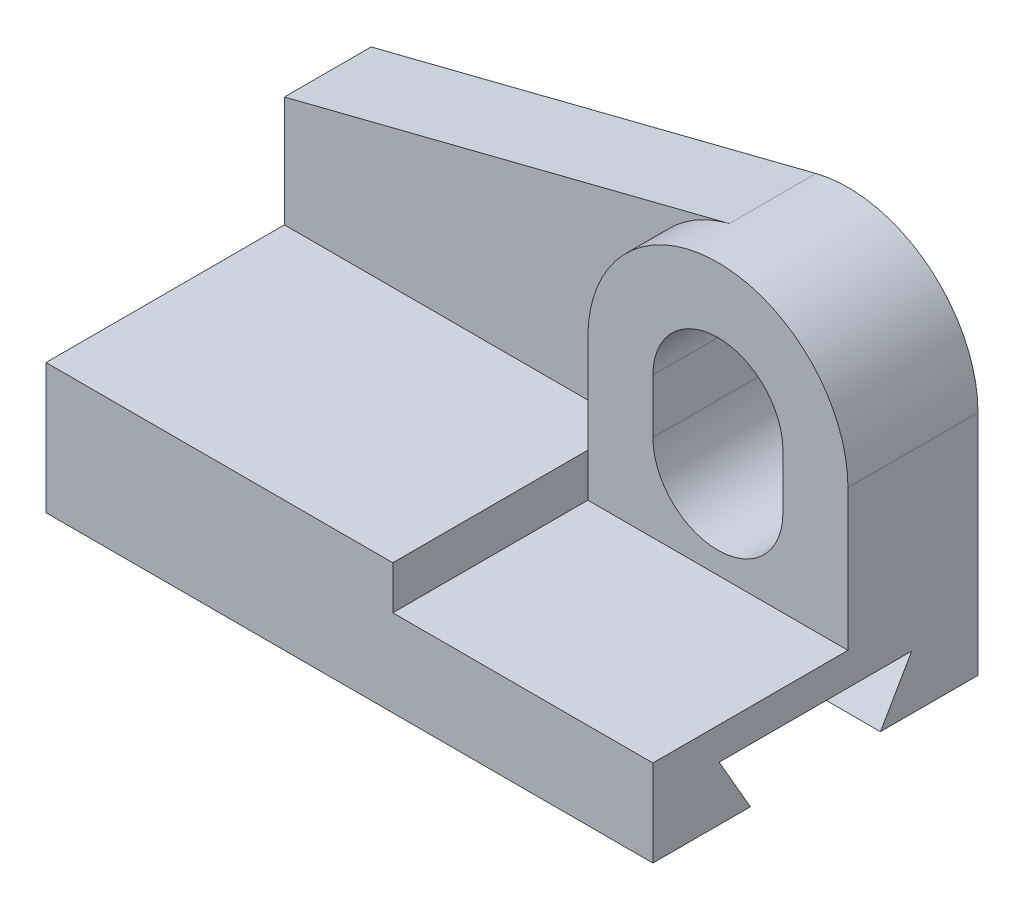
from build123d import *

# Parameters (mm, degrees)
SKETCH_1_W               = 56
SKETCH_1_H               = 30
EXTRUDE_1_DEPTH          = 8
SKETCH_3_W               = 32
SKETCH_3_H               = 30
EXTRUDE_2_DEPTH          = 4
EXTRUDE_3_DEPTH          = 12
EXTRUDE_4_DEPTH          = 8
CUT_EXTRUDE_1_DEPTH      = 46.803929962
CUT_EXTRUDE_1_DEPTH_BACK = 46.803929962


with BuildPart() as part:
    # 草图1 → 凸台-拉伸1 (new body)
    with BuildSketch(Plane(origin=(0, 0, 0), x_dir=(1, 0, 0), z_dir=(0, 1, 0))):
        Rectangle(SKETCH_1_W, SKETCH_1_H)
    extrude(amount=EXTRUDE_1_DEPTH)

    # 草图3 → 凸台-拉伸2 (add)
    with BuildSketch(Plane(origin=(0, 8, 0), x_dir=(1, 0, 0), z_dir=(0, 1, 0))):
        with Locations((-12, 0)):
            Rectangle(SKETCH_3_W, SKETCH_3_H)
    extrude(amount=EXTRUDE_2_DEPTH)

    # 草图7 → 凸台-拉伸3 (add)
    with BuildSketch(Plane.XY.offset(-15)):
        with BuildLine():
            Line((4, 21), (4, 12))
            Line((4, 12), (4, 8))
            Line((4, 8), (28, 8))
            Line((28, 8), (28, 21))
            ThreePointArc((28, 21), (23.368860948, 30.471002499), (13.050018612, 32.631750075))
            ThreePointArc((13.050018612, 32.631750075), (6.528997501, 28.368860948), (4, 21))
        make_face()
        with BuildLine():
            ThreePointArc((10, 21), (16, 27), (22, 21))
            Line((22, 21), (22, 16))
            ThreePointArc((22, 16), (16, 10), (10, 16))
            Line((10, 16), (10, 21))
        make_face(mode=Mode.SUBTRACT)
    extrude(amount=EXTRUDE_3_DEPTH)

    # 草图7<4> → 凸台-拉伸4 (add)
    with BuildSketch(Plane.XY.offset(-15)):
        with BuildLine():
            Line((-28, 22.220866923), (-28, 12))
            Line((-28, 12), (4, 12))
            Line((4, 12), (4, 21))
            ThreePointArc((4, 21), (6.528997501, 28.368860948), (13.050018612, 32.631750075))
            Line((13.050018612, 32.631750075), (-28, 22.220866923))
        make_face()
    extrude(amount=EXTRUDE_4_DEPTH)

    # 草图13 → 切除-拉伸1 (cut, two sides: drawn at the far end of the back side and taken through both)
    with BuildSketch(Plane(origin=(0, 0, 0), x_dir=(0, 0, -1), z_dir=(1, 0, 0)).offset(-CUT_EXTRUDE_1_DEPTH_BACK)):
        Polygon((-6, 0), (0, 0), (6, 0), (8.886751346, 5), (-8.886751346, 5), align=None)
    extrude(amount=CUT_EXTRUDE_1_DEPTH + CUT_EXTRUDE_1_DEPTH_BACK, mode=Mode.SUBTRACT)


solid = part.part
